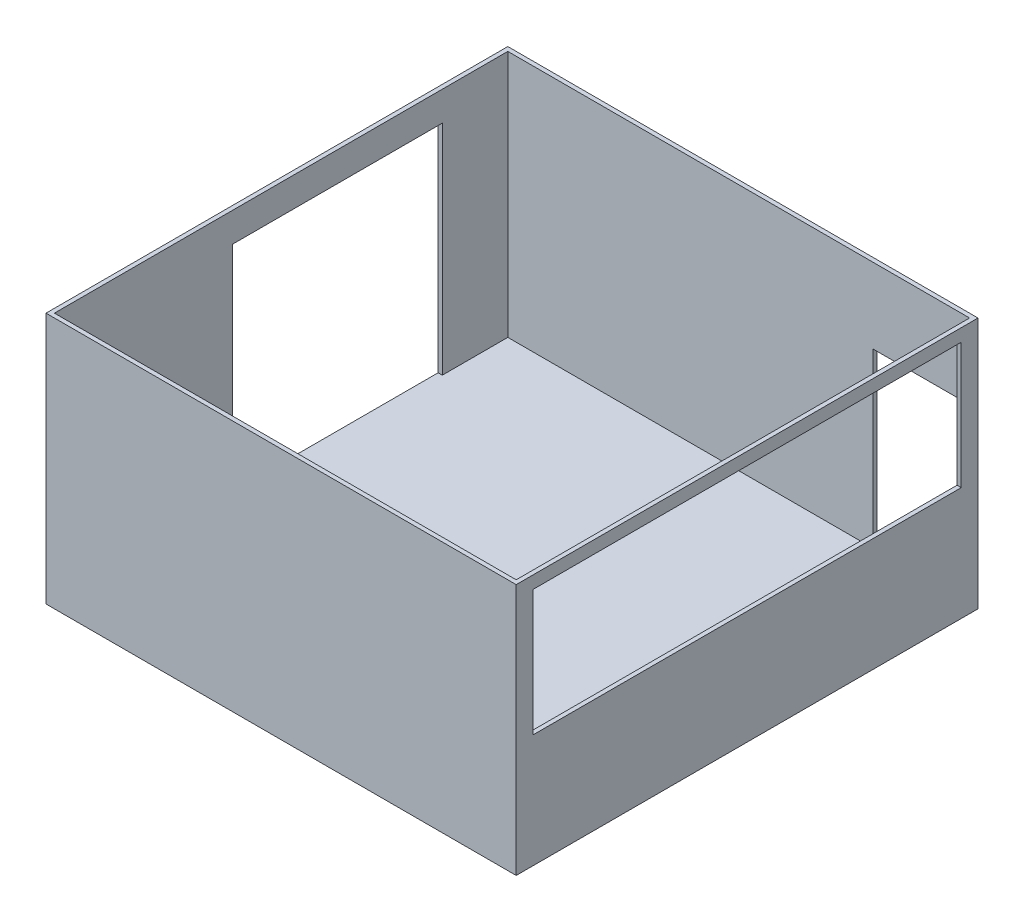
from build123d import *

# Parameters (mm, degrees)
SKETCH3_W           = 5600
SKETCH3_H           = 3000
BOSS_EXTRUDE2_DEPTH = 5500
SHELL2_T            = -50
SKETCH4_W           = 2500
SKETCH4_H           = 2600
CUT_EXTRUDE4_DEPTH  = 3500
SKETCH5_W           = 1100
SKETCH5_H           = 2100
CUT_EXTRUDE6_DEPTH  = 6309.129675268
SKETCH6_W           = 5100
SKETCH6_H           = 1500
CUT_EXTRUDE7_DEPTH  = 7957.286822381


with BuildPart() as part:
    # Sketch3 → Boss-Extrude2 (new body)
    with BuildSketch(Plane.XY):
        Rectangle(SKETCH3_W, SKETCH3_H)
    extrude(amount=BOSS_EXTRUDE2_DEPTH)

    # Shell2
    shell2_openings = [part.faces().sort_by_distance(p)[0] for p in [
        (0, 1500, 2750),
    ]]
    offset(amount=SHELL2_T, openings=shell2_openings, kind=Kind.INTERSECTION)

    # Sketch4 → Cut-Extrude4 (cut)
    with BuildSketch(Plane.ZY.offset(2800)):
        with Locations((2080, -150)):
            Rectangle(SKETCH4_W, SKETCH4_H)
    extrude(amount=-CUT_EXTRUDE4_DEPTH, mode=Mode.SUBTRACT)

    # Sketch5 → Cut-Extrude6 (cut, through all)
    with BuildSketch(Plane.XY.offset(50)):
        with Locations((2150, -445)):
            Rectangle(SKETCH5_W, SKETCH5_H)
    extrude(amount=-CUT_EXTRUDE6_DEPTH, mode=Mode.SUBTRACT)

    # Sketch6 → Cut-Extrude7 (cut, through all)
    with BuildSketch(Plane.ZY.offset(-2750)):
        with Locations((2750, 600)):
            Rectangle(SKETCH6_W, SKETCH6_H)
    extrude(amount=-CUT_EXTRUDE7_DEPTH, mode=Mode.SUBTRACT)


solid = part.part
